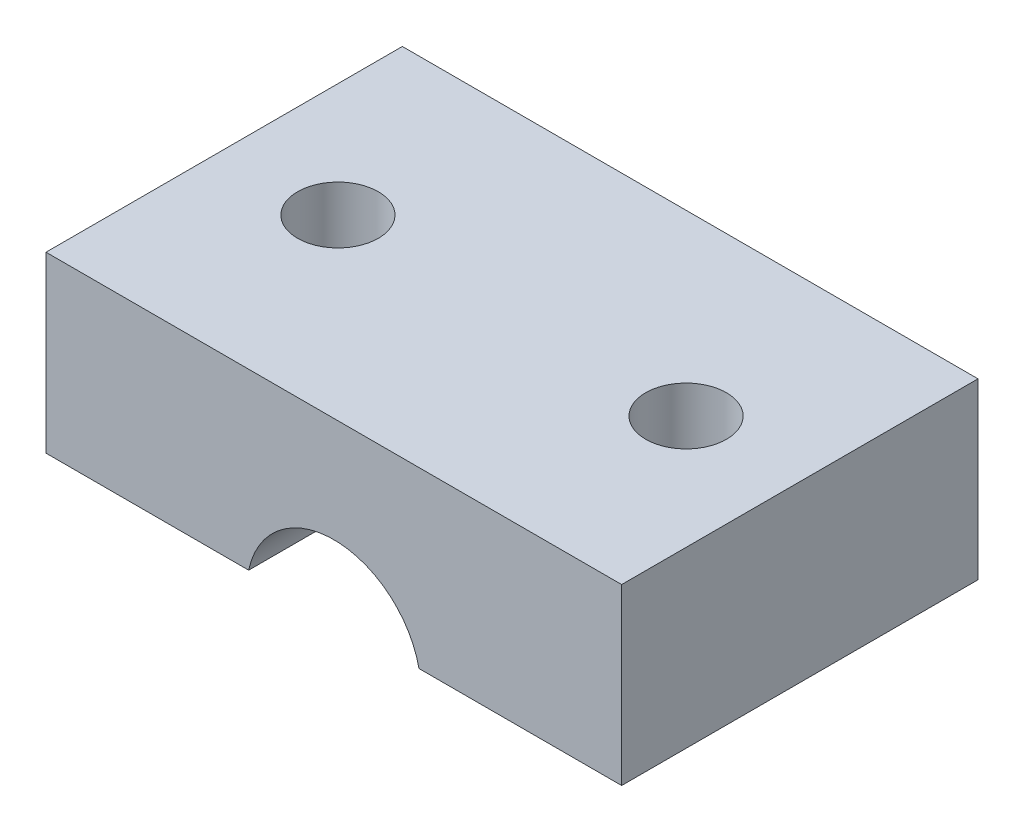
from build123d import *

# Parameters (mm, degrees)
SKETCH1_W           = 21
SKETCH1_H           = 13
SKETCH1_R           = 1.4732
BOSS_EXTRUDE1_DEPTH = 6.35
CUT_EXTRUDE1_DEPTH  = 13


with BuildPart() as part:
    # Sketch1 → Boss-Extrude1 (new body)
    with BuildSketch(Plane(origin=(0, 0, 0), x_dir=(1, 0, 0), z_dir=(0, 1, 0))):
        with Locations((20.5, -6.5)):
            Rectangle(SKETCH1_W, SKETCH1_H)
        with Locations(Location((14.15, -6.5, 0), (0, 0, 270))):
            Circle(SKETCH1_R, mode=Mode.SUBTRACT)
        with Locations(Location((26.85, -6.5, 0), (0, 0, 270))):
            Circle(SKETCH1_R, mode=Mode.SUBTRACT)
    extrude(amount=BOSS_EXTRUDE1_DEPTH)

    # Sketch2 → Cut-Extrude1 (cut)
    with BuildSketch(Plane(origin=(0, 0, 0), x_dir=(-1, 0, 0), z_dir=(0, 0, -1))):
        with BuildLine():
            ThreePointArc((-17.39358, 0), (-20.5, 2.518661837), (-23.60642, 0))
            Line((-23.60642, 0), (-17.39358, 0))
        make_face()
        with BuildLine():
            Line((-17.39358, 0), (-23.60642, 0))
            ThreePointArc((-23.60642, 0), (-20.829955679, -3.814146619), (-17.325, -0.656338163))
            ThreePointArc((-17.325, -0.656338163), (-17.342191543, -0.326382484), (-17.39358, 0))
        make_face()
    extrude(amount=-CUT_EXTRUDE1_DEPTH, mode=Mode.SUBTRACT)


solid = part.part
